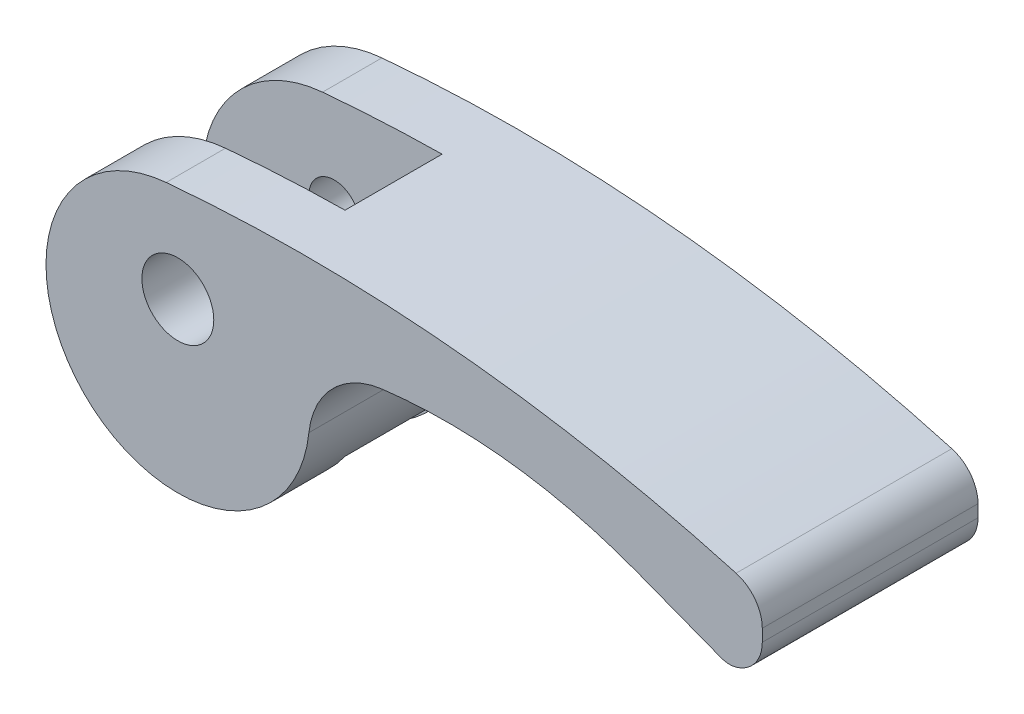
from build123d import *

# Parameters (mm, degrees)
SKETCH_1_R               = 11
EXTRUDE_1_DEPTH          = 18
EXTRUDE_2_DEPTH          = 18
FILLET_1_R               = 2
CUT_EXTRUDE_1_DEPTH      = 54.23509778
CUT_EXTRUDE_1_DEPTH_BACK = 54.23509778
SKETCH_3_W               = 20
SKETCH_3_H               = 8.1
SKETCH_4_R               = 3
CUT_EXTRUDE_2_DEPTH      = 4.95
SKETCH_5_R               = 2.1
CUT_EXTRUDE_3_DEPTH      = 54.23509778
FILLET_2_R               = 7


with BuildPart() as part:
    # Эскиз1 → Бобышка-Вытянуть1 (new body)
    with BuildSketch(Plane.XY):
        Circle(SKETCH_1_R)
    extrude(amount=EXTRUDE_1_DEPTH)

    # Эскиз2 → Бобышка-Вытянуть2 (add)
    with BuildSketch(Plane.XY):
        with BuildLine():
            Line((48.76838274, 3.610991898), (48.76838274, 2.595691289))
            ThreePointArc((48.76838274, 2.595691289), (47.88840056, 0.473069222), (45.76469978, -0.40430645))
            Line((45.76469978, -0.40430645), (38.399722319, 2.422654444))
            ThreePointArc((38.399722319, 2.422654444), (24.484941772, 5.325401982), (10.366167345, 3.680023719))
            Line((10.366167345, 3.680023719), (-0.971178616, 10.957043949))
            ThreePointArc((-0.971178616, 10.957043949), (23.009820936, 10.8960239), (46.584150264, 6.497949353))
            ThreePointArc((46.584150264, 6.497949353), (48.160798106, 5.421060602), (48.76838274, 3.610991898))
        make_face()
    extrude(amount=EXTRUDE_2_DEPTH)

    # Скругление1
    fillet_1_edges = [part.edges().sort_by_distance(p)[0] for p in [
        (45.76469978, -0.40430645, 9),
    ]]
    fillet(fillet_1_edges, radius=FILLET_1_R)

    # Эскиз3 → Вырез-Вытянуть1 (cut, two sides: drawn at the far end of the back side and taken through both)
    with BuildSketch(Plane(origin=(0, 0, 0), x_dir=(1, 0, 0), z_dir=(0, 1, 0)).offset(-CUT_EXTRUDE_1_DEPTH_BACK)):
        with Locations((-1, -9)):
            Rectangle(SKETCH_3_W, SKETCH_3_H)
    extrude(amount=CUT_EXTRUDE_1_DEPTH + CUT_EXTRUDE_1_DEPTH_BACK, mode=Mode.SUBTRACT)

    # Эскиз4 → Вырез-Вытянуть2 (cut)
    with BuildSketch(Plane.XY.offset(18)):
        with Locations((0, 3)):
            Circle(SKETCH_4_R)
    extrude(amount=-CUT_EXTRUDE_2_DEPTH, mode=Mode.SUBTRACT)

    # Эскиз5 → Вырез-Вытянуть3 (cut, through all)
    with BuildSketch(Plane.XY.offset(18)):
        with Locations((0, 3)):
            Circle(SKETCH_5_R)
    extrude(amount=-CUT_EXTRUDE_3_DEPTH, mode=Mode.SUBTRACT)

    # Скругление2
    fillet_2_edges = [part.edges().sort_by_distance(p)[0] for p in [
        (10.366167345, 3.680023719, 9),
    ]]
    fillet(fillet_2_edges, radius=FILLET_2_R)


solid = part.part
